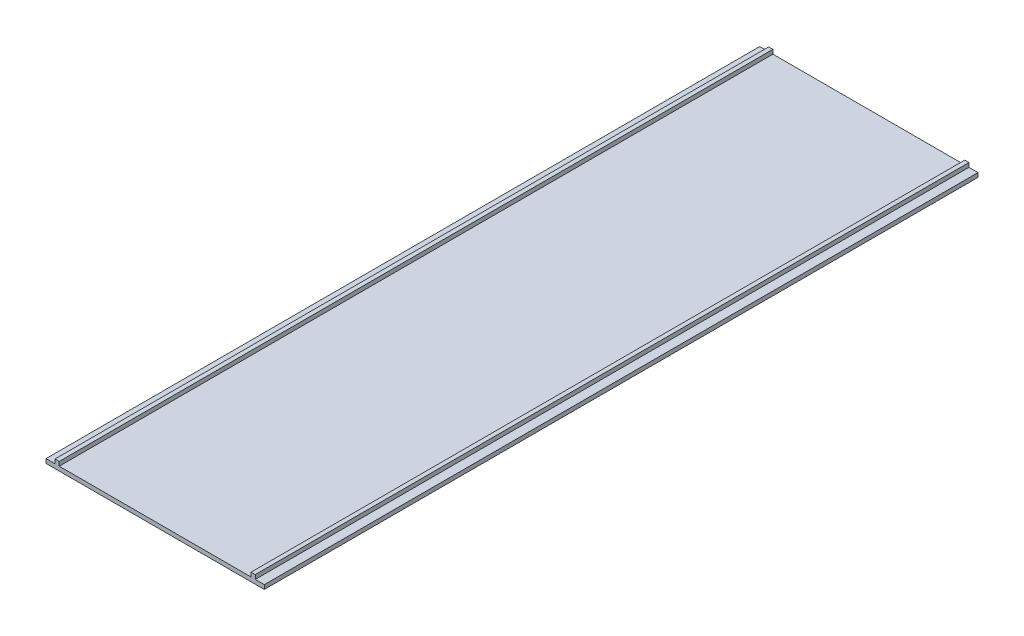
from build123d import *

# Parameters (mm, degrees)
SKETCH_1_W      = 104
SKETCH_1_H      = 340
EXTRUDE_1_DEPTH = 2
SKETCH_2_W      = 2
SKETCH_2_H      = 2
EXTRUDE_2_DEPTH = 340


with BuildPart() as part:
    # Эскиз1 → Бобышка-Вытянуть1 (new body)
    with BuildSketch(Plane(origin=(0, 0, 0), x_dir=(1, 0, 0), z_dir=(0, 1, 0))):
        Rectangle(SKETCH_1_W, SKETCH_1_H)
    extrude(amount=EXTRUDE_1_DEPTH)

    # Эскиз2 → Бобышка-Вытянуть2 (add)
    with BuildSketch(Plane.XY.offset(170)):
        with Locations((-46.7, 3)):
            Rectangle(SKETCH_2_W, SKETCH_2_H)
    extrude_2 = extrude(amount=-EXTRUDE_2_DEPTH)

    # Зеркальное отражение1: Бобышка-Вытянуть2 across plane
    add(extrude_2.mirror(Plane(origin=(0, 0, 0), x_dir=(0, 0, 1), z_dir=(1, 0, 0))))


solid = part.part
